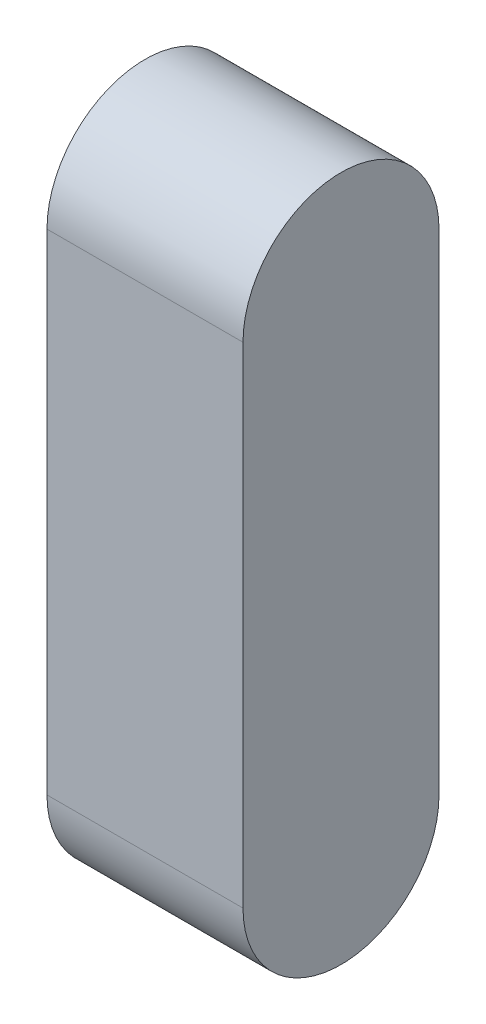
from build123d import *

# Parameters (mm, degrees)
BOSS_EXTRUDE1_DEPTH = 2


with BuildPart() as part:
    # Sketch1 → Boss-Extrude1 (new, symmetric)
    with BuildSketch(Plane.YZ):
        with BuildLine():
            Line((-5, 2), (5, 2))
            ThreePointArc((5, 2), (7, 0), (5, -2))
            Line((5, -2), (-5, -2))
            ThreePointArc((-5, -2), (-7, 0), (-5, 2))
        make_face()
    extrude(amount=BOSS_EXTRUDE1_DEPTH, both=True)


solid = part.part
